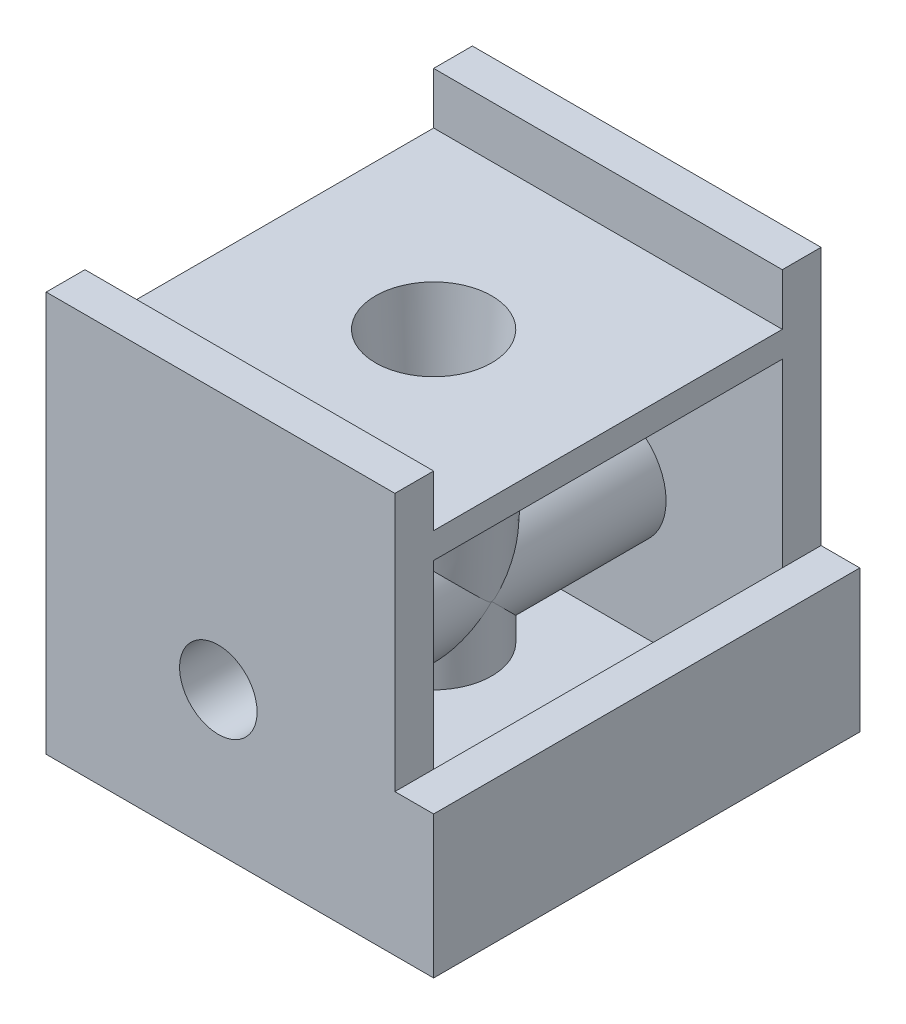
from build123d import *

# Parameters (mm, degrees)
SKETCH1_W                     = 33
SKETCH1_H                     = 33
SKETCH1_W_2                   = 27
SKETCH1_H_2                   = 27
BOSS_EXTRUDE1_DEPTH           = 30
SKETCH3_W                     = 27
SKETCH3_H                     = 30
CUT_EXTRUDE1_DEPTH            = 30
SKETCH4_W                     = 33
SKETCH4_H                     = 1
BOSS_EXTRUDE2_DEPTH           = 33
BOSS_EXTRUDE4_DEPTH           = 4.8
CUT_EXTRUDE3_DEPTH            = 2.8
BOSS_EXTRUDE5_DEPTH           = 4.8
CUT_EXTRUDE5_DEPTH            = 2.8
SKETCH12_W                    = 3
SKETCH12_H                    = 27
CUT_EXTRUDE6_DEPTH            = 10
SKETCH13_W                    = 3
SKETCH13_H                    = 37.394696754
CUT_EXTRUDE7_DEPTH            = 39.800773188
SKETCH15_R                    = 4.5
BOSS_EXTRUDE6_DEPTH           = 33
BOSS_EXTRUDE8_DEPTH           = 27
SKETCH24_R                    = 4.5
BOSS_EXTRUDE7_DEPTH           = 5
BOSS_EXTRUDE7_OTHER_WAY_DEPTH = 16
BOSS_EXTRUDE7_OTHER_WAY_TAPER = -3
SKETCH27_R                    = 4.5
CUT_EXTRUDE12_DEPTH           = 21
CUT_EXTRUDE12_DRAFT           = -5
SKETCH31_R                    = 3
CUT_EXTRUDE14_DEPTH           = 33
CUT_EXTRUDE15_DEPTH           = 20


with BuildPart() as part:
    # Sketch1 → Boss-Extrude1 (new body)
    with BuildSketch(Plane(origin=(0, 0, 0), x_dir=(1, 0, 0), z_dir=(0, 1, 0))):
        Rectangle(SKETCH1_W, SKETCH1_H)
        Rectangle(SKETCH1_W_2, SKETCH1_H_2, mode=Mode.SUBTRACT)
    extrude(amount=BOSS_EXTRUDE1_DEPTH)

    # Sketch3 → Cut-Extrude1 (cut)
    with BuildSketch(Plane(origin=(-13.5, 0, 0), x_dir=(0, 0, -1), z_dir=(1, 0, 0))):
        with Locations((0, 15)):
            Rectangle(SKETCH3_W, SKETCH3_H)
    extrude(amount=-CUT_EXTRUDE1_DEPTH, mode=Mode.SUBTRACT)

    # Sketch4 → Boss-Extrude2 (add)
    with BuildSketch(Plane(origin=(16.5, 0, 0), x_dir=(0, 0, -1), z_dir=(1, 0, 0))):
        with Locations((0, -0.5)):
            Rectangle(SKETCH4_W, SKETCH4_H)
    extrude(amount=-BOSS_EXTRUDE2_DEPTH)

    # Sketch7 → Boss-Extrude4 (add)
    with BuildSketch(Plane(origin=(0, 0, 0), x_dir=(1, 0, 0), z_dir=(0, 1, 0))):
        Polygon((13.5, 13.5), (9.5, 13.5), (13.5, 9.5), align=None)
    extrude(amount=BOSS_EXTRUDE4_DEPTH)

    # Sketch8 → Cut-Extrude3 (cut)
    with BuildSketch(Plane(origin=(0, 0, 0), x_dir=(1, 0, 0), z_dir=(0, 1, 0))):
        Polygon((13.5, 9.5), (9.5, 13.5), (13.5, 13.5), align=None)
    extrude(amount=CUT_EXTRUDE3_DEPTH, mode=Mode.SUBTRACT)

    # Sketch9 → Boss-Extrude5 (add)
    with BuildSketch(Plane(origin=(0, 0, 0), x_dir=(1, 0, 0), z_dir=(0, 1, 0))):
        Polygon((13.5, -13.5), (13.5, -9.5), (9.5, -13.5), align=None)
    extrude(amount=BOSS_EXTRUDE5_DEPTH)

    # Sketch10 → Cut-Extrude5 (cut)
    with BuildSketch(Plane(origin=(0, 0, 0), x_dir=(1, 0, 0), z_dir=(0, 1, 0))):
        Polygon((9.5, -13.5), (13.5, -9.5), (13.5, -13.5), align=None)
    extrude(amount=CUT_EXTRUDE5_DEPTH, mode=Mode.SUBTRACT)

    # Sketch12 → Cut-Extrude6 (cut)
    with BuildSketch(Plane(origin=(0, 0, 0), x_dir=(1, 0, 0), z_dir=(0, 1, 0))):
        with Locations((-15, 0)):
            Rectangle(SKETCH12_W, SKETCH12_H)
    extrude(amount=-CUT_EXTRUDE6_DEPTH, mode=Mode.SUBTRACT)

    # Sketch13 → Cut-Extrude7 (cut, through all)
    with BuildSketch(Plane.XZ.offset(1)):
        with Locations((-15, -2.197348377)):
            Rectangle(SKETCH13_W, SKETCH13_H)
    extrude(amount=-CUT_EXTRUDE7_DEPTH, mode=Mode.SUBTRACT)

    # Sketch15 → Boss-Extrude6 (add, through all)
    with BuildSketch(Plane.XY.offset(16.5)):
        with Locations((0, 10)):
            Circle(SKETCH15_R)
    extrude(amount=-BOSS_EXTRUDE6_DEPTH)

    # Sketch26 → Boss-Extrude8 (add, through all)
    with BuildSketch(Plane.ZY.offset(-13.5)):
        Polygon((13.5, 26), (-13.5, 26), (-13.5, 24), (0, 24), (13.5, 24), align=None)
    extrude(amount=BOSS_EXTRUDE8_DEPTH)

    # Sketch24 → Boss-Extrude7 (add)
    with BuildSketch(Plane(origin=(0, 10, 0), x_dir=(1, 0, 0), z_dir=(0, 1, 0))):
        with Locations(Location((0, 0, 0), (0, 0, 270))):
            Circle(SKETCH24_R)
    extrude(amount=-BOSS_EXTRUDE7_DEPTH)

    # Sketch24 → Boss-Extrude7 other way (add)
    with BuildSketch(Plane(origin=(0, 10, 0), x_dir=(1, 0, 0), z_dir=(0, 1, 0))):
        with Locations(Location((0, 0, 0), (0, 0, 270))):
            Circle(SKETCH24_R)
    extrude(amount=BOSS_EXTRUDE7_OTHER_WAY_DEPTH, taper=BOSS_EXTRUDE7_OTHER_WAY_TAPER)


with BuildPart() as cut_extrude12_tool:
    # Sketch27 → Cut-Extrude12 (with draft: the straight prism first)
    with BuildSketch(Plane(origin=(0, 26, 0), x_dir=(1, 0, 0), z_dir=(0, 1, 0))):
        with Locations(Location((0, 0, 0), (0, 0, 270))):
            Circle(SKETCH27_R)
    extrude(amount=-CUT_EXTRUDE12_DEPTH)
    # Cut-Extrude12: the draft: its side faces are tilted about the plane it starts from
    cut_extrude12_sides = [cut_extrude12_tool.faces().sort_by_distance(p)[0] for p in [
        (0, 15.5, -4.5),
    ]]
    draft(cut_extrude12_sides, Plane(origin=(0, 26, 0), x_dir=(1, 0, 0), z_dir=(0, 1, 0)), CUT_EXTRUDE12_DRAFT)


with BuildPart() as part_1:
    add(part.part)

    # Cut-Extrude12: cut by cut_extrude12_tool
    add(cut_extrude12_tool.part, mode=Mode.SUBTRACT)

    # Sketch31 → Cut-Extrude14 (cut)
    with BuildSketch(Plane.XY.offset(16.5)):
        with Locations((-0.171414506, 10)):
            Circle(SKETCH31_R)
    extrude(amount=-CUT_EXTRUDE14_DEPTH, mode=Mode.SUBTRACT)

    # Sketch32 → Cut-Extrude15 (cut)
    with BuildSketch(Plane(origin=(0, 30, 0), x_dir=(1, 0, 0), z_dir=(0, 1, 0))):
        Polygon((13.5, 13.5), (13.5, 17.645785923), (20.004532671, 17.645785923), (20.004532671, -18.642828809), (13.5, -18.642828809), (13.5, -13.5), align=None)
    extrude(amount=-CUT_EXTRUDE15_DEPTH, mode=Mode.SUBTRACT)


solid = part_1.part
